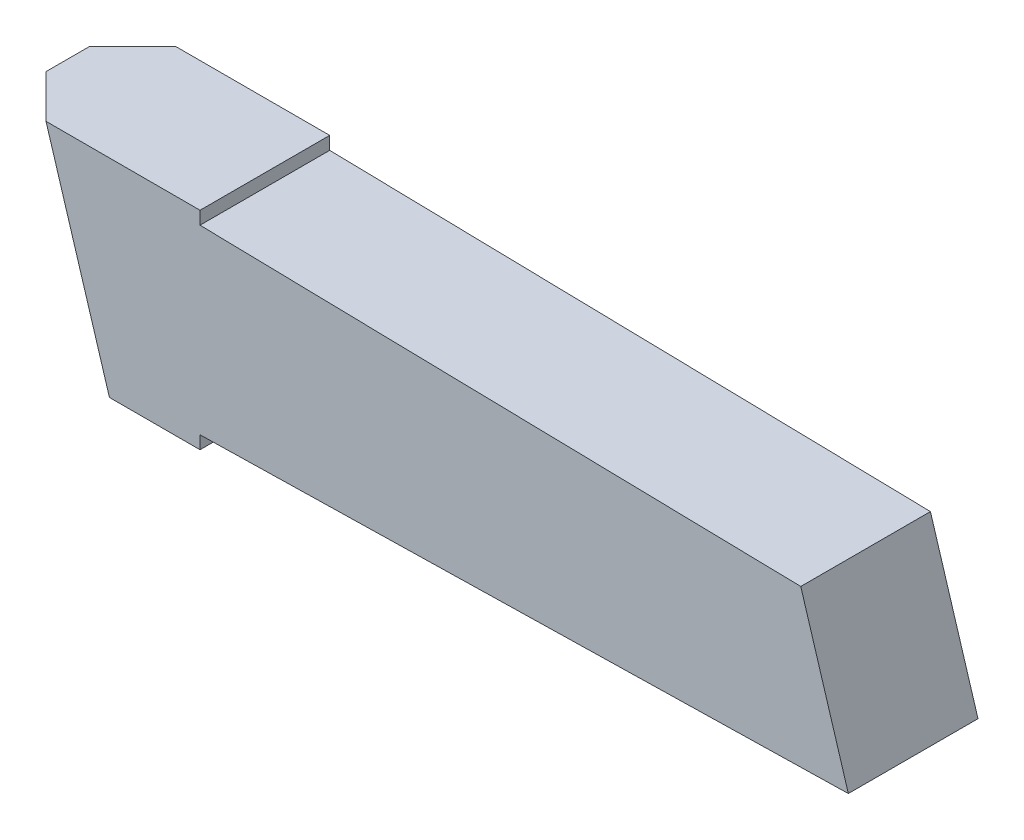
from build123d import *

# Parameters (mm, degrees)
BASE_EXTRUDE_DEPTH    = 2.5
CORTE_EXTRUS_O1_DEPTH = 10


with BuildPart() as part:
    # Sketch1 → Base-Extrude (new, symmetric)
    with BuildSketch(Plane.XY):
        Polygon((-5.154154548, -4), (-7.6, 4), (0, 4), (0, 3.5), (23.165615911, 3.019042465), (25, -2.980957535), (0, -3.5), (0, -4), align=None)
    extrude(amount=BASE_EXTRUDE_DEPTH, both=True)

    # Esboço1 → Corte-extrusão1 (cut, along a direction that is not the sketch's normal)
    with BuildSketch(Plane(origin=(0, 4, 0), x_dir=(1, 0, 0), z_dir=(0, 1, 0))):
        Polygon((-5.94, -2.5), (-7.6, -0.84), (-7.6, -2.5), align=None)
        Polygon((-5.94, 2.5), (-7.6, 0.84), (-7.6, 2.5), align=None)
    extrude(amount=-CORTE_EXTRUS_O1_DEPTH, dir=(-0.29237170472273044, 0.9563047559630375, 0), mode=Mode.SUBTRACT)


solid = part.part
